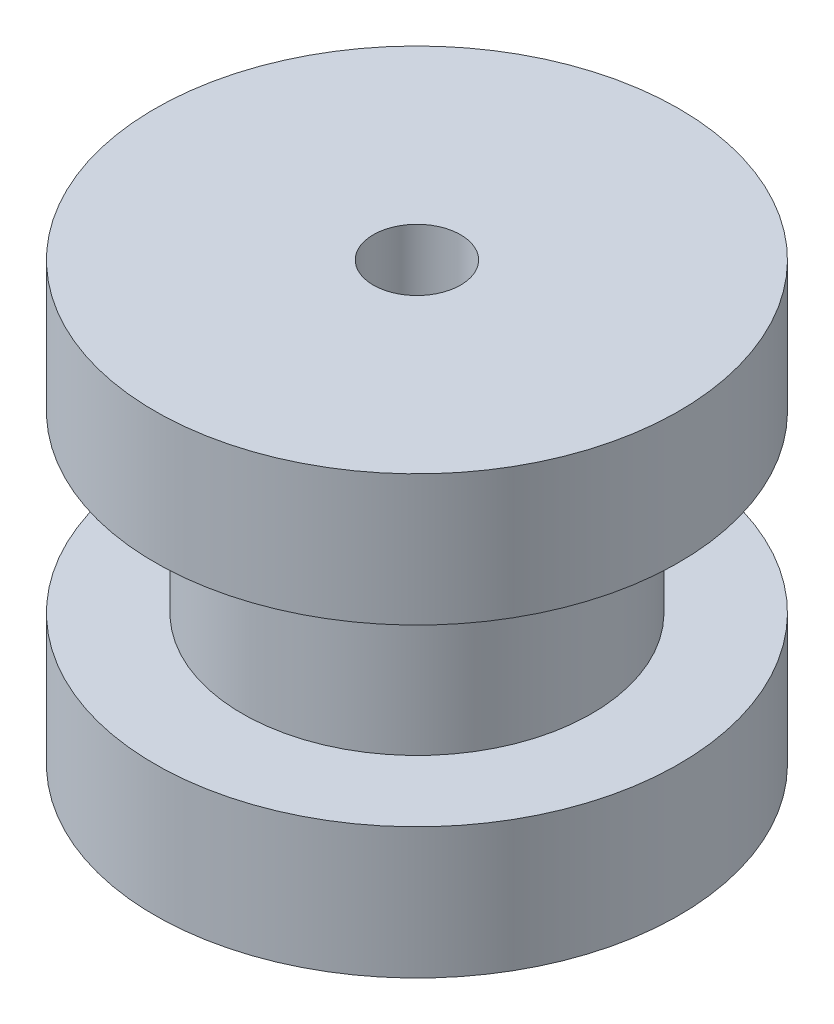
from build123d import *

# Parameters (mm, degrees)
CORTAR_EXTRUIR1_DEPTH      = 41.890096601
CORTAR_EXTRUIR1_DEPTH_BACK = 41.890096601
CROQUIS2_R                 = 0.5
CORTAR_EXTRUIR2_DEPTH      = 27.400757565
CORTAR_EXTRUIR2_DEPTH_BACK = 27.400757565
CROQUIS3_R                 = 1


with BuildPart() as part:
    # Croquis1 → Revolución1 (revolve)
    with BuildSketch(Plane.XY, mode=Mode.PRIVATE) as revoluci_n1_sk:
        Polygon((0.9, 20), (0.9, 5), (6, 5), (6, 2), (4, 2), (4, -2), (6, -2), (6, -5), (0.9, -5), (0.9, -20), (0, -20), (0, 20), align=None)
    revolve(revoluci_n1_sk.sketch.rotate(Axis((0, 0, 0), (0, 1, 0)), 90), axis=Axis((0, 0, 0), (0, 1, 0)))

    # Croquis2 → Cortar-Extruir1 (cut, two sides: drawn at the far end of the back side and taken through both)
    with BuildSketch(Plane(origin=(0, 20, 0), x_dir=(1, 0, 0), z_dir=(0, 1, 0)).offset(-CORTAR_EXTRUIR1_DEPTH_BACK)):
        with Locations(Location((0, 0, 0), (0, 0, 270))):
            Circle(CROQUIS2_R)
    extrude(amount=CORTAR_EXTRUIR1_DEPTH + CORTAR_EXTRUIR1_DEPTH_BACK, mode=Mode.SUBTRACT)

    # Croquis3 → Cortar-Extruir2 (cut, two sides: drawn at the far end of the back side and taken through both)
    with BuildSketch(Plane(origin=(0, 5, 0), x_dir=(1, 0, 0), z_dir=(0, 1, 0)).offset(-CORTAR_EXTRUIR2_DEPTH_BACK)):
        with Locations(Location((0, 0, 0), (0, 0, 270))):
            Circle(CROQUIS3_R)
    extrude(amount=CORTAR_EXTRUIR2_DEPTH + CORTAR_EXTRUIR2_DEPTH_BACK, mode=Mode.SUBTRACT)


solid = part.part
